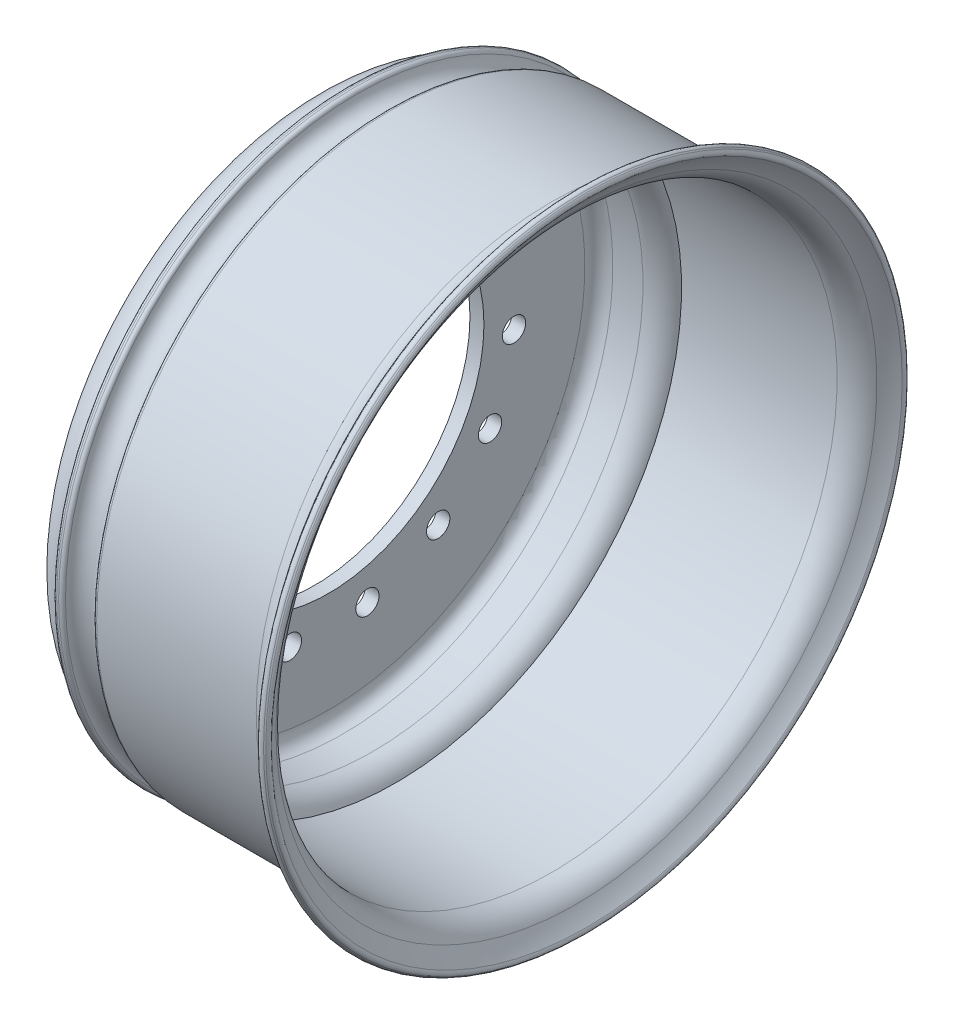
from build123d import *

# Parameters (mm, degrees)
SKETCH3_R          = 7.5
CUT_EXTRUDE1_DEPTH = 345.289321626
CIRPATTERN1_COUNT  = 15
FILLET1_R          = 2.5
FILLET2_R          = 2.5


with BuildPart() as part:
    # Sketch1 → Revolve2 (revolve)
    with BuildSketch(Plane.XY, mode=Mode.PRIVATE) as revolve2_sk:
        with BuildLine():
            Line((0, 190), (6, 190))
            ThreePointArc((6, 190), (16, 180), (26, 190))
            Line((26, 190), (131, 190))
            ThreePointArc((131, 190), (137.326426611, 191.719168569), (141.912662216, 196.403787786))
            ThreePointArc((141.912662216, 196.403787786), (146.083516094, 202.924819463), (151, 208.903787786))
            Line((151, 208.903787786), (155.399246684, 204.823759769))
            ThreePointArc((155.399246684, 204.823759769), (150.936592061, 199.396696214), (147.150740079, 193.477605923))
            ThreePointArc((147.150740079, 193.477605923), (140.363111384, 186.544369482), (131, 184))
            Line((131, 184), (30.832396974, 184))
            ThreePointArc((30.832396974, 184), (24.94427191, 176.733500839), (16, 174))
            Line((16, 174), (-3.38749457, 174))
            ThreePointArc((-3.38749457, 174), (-9.751455601, 171.363961031), (-12.38749457, 165))
            Line((-12.38749457, 165), (-12.38749457, 100))
            Line((-12.38749457, 100), (-21.38749457, 100))
            Line((-21.38749457, 100), (-21.38749457, 165))
            ThreePointArc((-21.38749457, 165), (-16.115416631, 177.727922061), (-3.38749457, 183))
            Line((-3.38749457, 183), (1.61250543, 183))
            ThreePointArc((1.61250543, 183), (1.381500916, 183.496194611), (1.167603026, 184))
            Line((1.167603026, 184), (0, 184))
            Line((0, 184), (0, 190))
        make_face()
    revolve(revolve2_sk.sketch.rotate(Axis((0, 0, 0), (1, 0, 0)), 90), axis=Axis((0, 0, 0), (1, 0, 0)))

    # Sketch3 → Cut-Extrude1 (cut, through all)
    with BuildSketch(Plane.ZY.offset(21.38749457)):
        with Locations((0, 120)):
            Circle(SKETCH3_R)
    cut_extrude1 = extrude(amount=-CUT_EXTRUDE1_DEPTH, mode=Mode.SUBTRACT)

    # CirPattern1: Cut-Extrude1 ×15 about axis
    cirpattern1_axis = Axis((0, 0, 0), (1, 0, 0))
    for i in range(1, CIRPATTERN1_COUNT):
        add(cut_extrude1.rotate(cirpattern1_axis, i * 360 / CIRPATTERN1_COUNT), mode=Mode.SUBTRACT)

    # Fillet1
    fillet1_edges = [part.edges().sort_by_distance(p)[0] for p in [
        (151, 0, -208.903787786),
        (155.399246684, 0, -204.823759769),
    ]]
    fillet(fillet1_edges, radius=FILLET1_R)

    # Fillet2
    fillet2_edges = [part.edges().sort_by_distance(p)[0] for p in [
        (0, 0, -190),
        (6, 0, -190),
        (26, 0, -190),
    ]]
    fillet(fillet2_edges, radius=FILLET2_R)


solid = part.part
